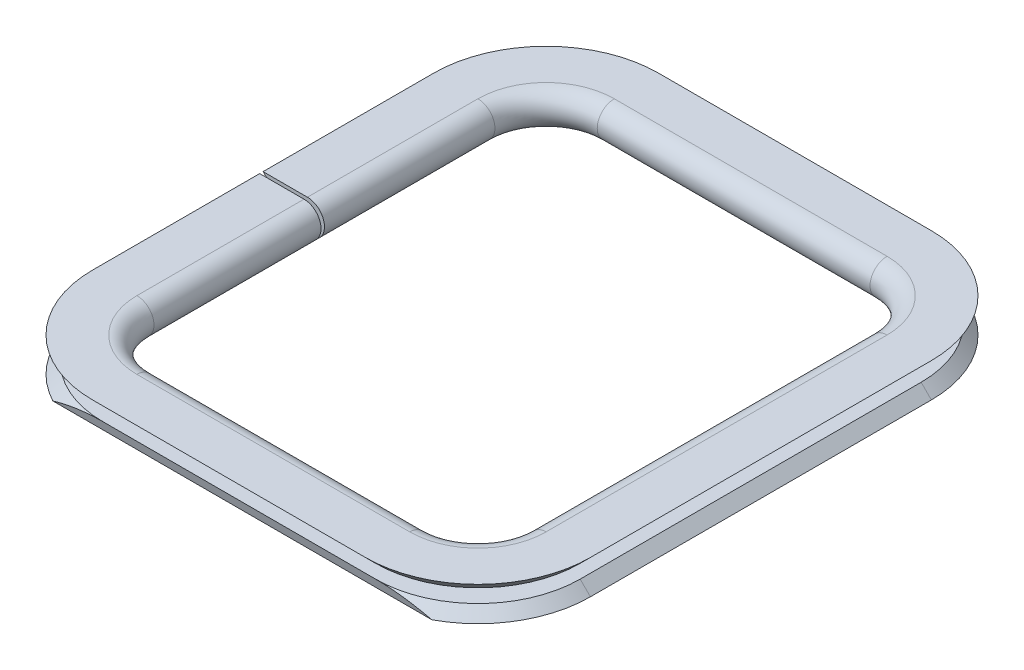
from build123d import *

# Parameters (mm, degrees)
ENL_V_MAT_EXTRU_1_DEPTH      = 79.42671739
ENL_V_MAT_EXTRU_1_DEPTH_BACK = 79.42671739


with BuildPart() as part:
    # Balayage1: sweep along a path in Esquisse2
    with BuildLine(Plane(origin=(0, 0, 0), x_dir=(1, 0, 0), z_dir=(0, 1, 0))) as balayage1_path:
        Line((0, 0), (0, 25))
        ThreePointArc((0, 25), (2.928932188, 32.071067812), (10, 35))
        Line((10, 35), (50, 35))
        ThreePointArc((50, 35), (57.071067812, 32.071067812), (60, 25))
        Line((60, 25), (60, -25))
        ThreePointArc((60, -25), (57.071067812, -32.071067812), (50, -35))
        Line((50, -35), (10, -35))
        ThreePointArc((10, -35), (2.928932188, -32.071067812), (0, -25))
        Line((0, -25), (0, -0.5))
    # Esquisse1 → Balayage1 (sweep)
    with BuildSketch(Plane.XY):
        with BuildLine():
            Line((0, -1), (0, 1))
            Line((0, 1), (-5, 1))
            Line((-5, 1), (-6.5, 2.5))
            Line((-6.5, 2.5), (0, 2.5))
            ThreePointArc((0, 2.5), (2.5, 0), (0, -2.5))
            Line((0, -2.5), (-6.5, -2.5))
            Line((-6.5, -2.5), (-5, -1))
            Line((-5, -1), (0, -1))
        make_face()
    sweep(path=balayage1_path.line)

    # Esquisse3 → Enlèv. mat.-Extru.1 (cut, two sides: drawn at the far end of the back side and taken through both)
    with BuildSketch(Plane(origin=(0, 0, 0), x_dir=(0, 0, -1), z_dir=(1, 0, 0)).offset(-ENL_V_MAT_EXTRU_1_DEPTH_BACK)):
        Polygon((-40, -1), (-43.95658592, -1), (-43.95658592, -4.130810218), (-39.042815259, -4.130810218), align=None)
    extrude(amount=ENL_V_MAT_EXTRU_1_DEPTH + ENL_V_MAT_EXTRU_1_DEPTH_BACK, mode=Mode.SUBTRACT)


solid = part.part
